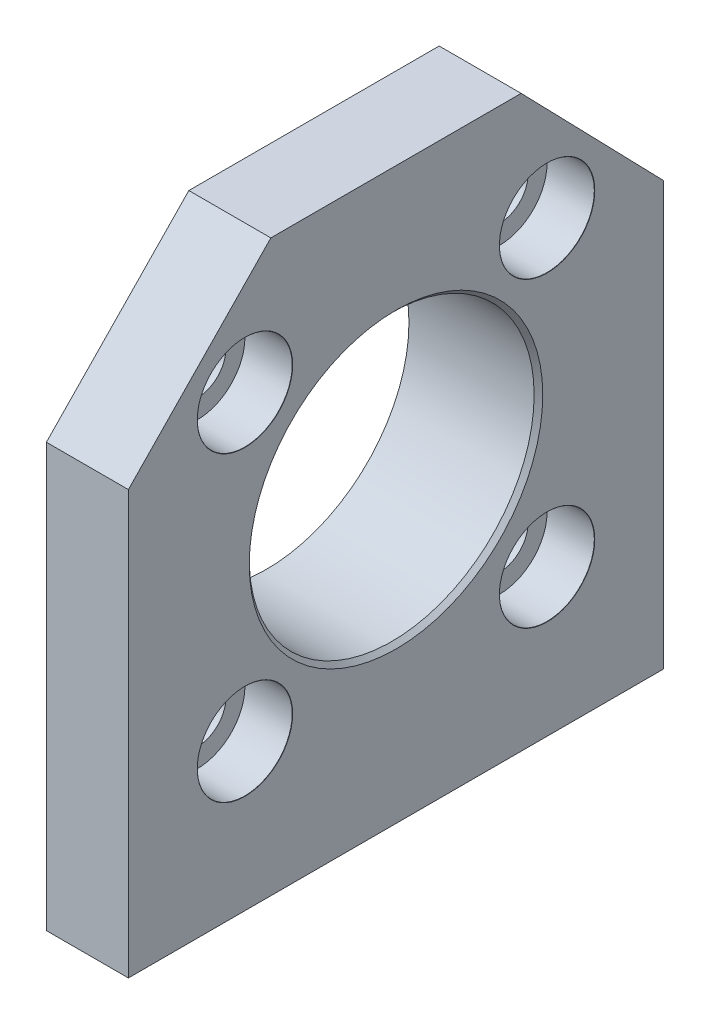
from build123d import *

# Parameters (mm, degrees)
ESBO_O1_W                                    = 31
ESBO_O1_H                                    = 49
RESSALTO_EXTRUS_O1_DEPTH                     = 9.5
REBAIXO_PARA_PARAFUSO_COM_CABE_A_RED_2_COUNT = 2
REBAIXO_PARA_PARAFUSO_COM_CABE_A_RED_2_PITCH = 35
REBAIXO_PARA_PARAFUSO_COM_CABE_A_RED_3_COUNT = 2
REBAIXO_PARA_PARAFUSO_COM_CABE_A_RED_3_PITCH = 49.497474683
REBAIXO_PARA_PARAFUSO_COM_CABE_A_RED_4_COUNT = 2
REBAIXO_PARA_PARAFUSO_COM_CABE_A_RED_4_PITCH = 35
ESBO_O8_R                                    = 19.9
RESSALTO_EXTRUS_O2_DEPTH                     = 5.5
ESBO_O5_R                                    = 16.5
CORTE_EXTRUS_O1_DEPTH                        = 92.787798753
CHANFRO1_SIZE                                = 0.5


with BuildPart() as part:
    # Esboço1 → Ressalto-extrusão1 (new body)
    with BuildSketch(Plane(origin=(0, 0, 0), x_dir=(0, 0, -1), z_dir=(1, 0, 0))):
        Polygon((16.5, 66), (0, 49), (31, 49), (31, 66), align=None)
        Polygon((31, 66), (31, 49), (62, 49), (45.5, 66), align=None)
        with Locations((15.5, 24.5)):
            Rectangle(ESBO_O1_W, ESBO_O1_H)
        with Locations((46.5, 24.5)):
            Rectangle(ESBO_O1_W, ESBO_O1_H)
    extrude(amount=-RESSALTO_EXTRUS_O1_DEPTH)

    # Esboço4 → Rebaixo para parafuso com cabeça redonda de M61 (revolve, cut)
    with BuildSketch(Plane(origin=(0, 52, -13.5), x_dir=(0, 0, -1), z_dir=(0, 1, 0))):
        Polygon((0, 0), (0, 9.5), (3.3, 9.5), (3.3, 5.5), (5.5, 5.5), (5.5, 0.025), (5.525, 0), align=None)
    rebaixo_para_parafuso_com_cabe_a_redonda = revolve(axis=Axis((6.35, 52, -13.5), (-1, 0, 0)), mode=Mode.SUBTRACT)

    # Rebaixo para parafuso com cabe_a red 2: Rebaixo para parafuso com cabeça redonda de M61 ×2
    with Locations(*[(0, 0, -i * REBAIXO_PARA_PARAFUSO_COM_CABE_A_RED_2_PITCH) for i in range(1, REBAIXO_PARA_PARAFUSO_COM_CABE_A_RED_2_COUNT)]):
        add(rebaixo_para_parafuso_com_cabe_a_redonda, mode=Mode.SUBTRACT)

    # Rebaixo para parafuso com cabe_a red 3: Rebaixo para parafuso com cabeça redonda de M61 ×2
    with Locations(*[Vector(0, -0.7071067811865477, -0.7071067811865475) * (i * REBAIXO_PARA_PARAFUSO_COM_CABE_A_RED_3_PITCH) for i in range(1, REBAIXO_PARA_PARAFUSO_COM_CABE_A_RED_3_COUNT)]):
        add(rebaixo_para_parafuso_com_cabe_a_redonda, mode=Mode.SUBTRACT)

    # Rebaixo para parafuso com cabe_a red 4: Rebaixo para parafuso com cabeça redonda de M61 ×2
    with Locations(*[(0, -i * REBAIXO_PARA_PARAFUSO_COM_CABE_A_RED_4_PITCH, 0) for i in range(1, REBAIXO_PARA_PARAFUSO_COM_CABE_A_RED_4_COUNT)]):
        add(rebaixo_para_parafuso_com_cabe_a_redonda, mode=Mode.SUBTRACT)

    # Esboço8 → Ressalto-extrusão2 (add)
    with BuildSketch(Plane.ZY.offset(9.5)):
        with Locations(Location((-31, 34.5, 0), (0, 0, 180))):
            Circle(ESBO_O8_R)
    extrude(amount=RESSALTO_EXTRUS_O2_DEPTH)

    # Esboço5 → Corte-extrusão1 (cut, through all)
    with BuildSketch(Plane(origin=(0, 0, 0), x_dir=(0, 0, -1), z_dir=(1, 0, 0))):
        with Locations((31, 34.5)):
            Circle(ESBO_O5_R)
    extrude(amount=-CORTE_EXTRUS_O1_DEPTH, mode=Mode.SUBTRACT)

    # Chanfro1
    chanfro1_edges = [part.edges().sort_by_distance(p)[0] for p in [
        (0, 34.5, -14.5),
    ]]
    chamfer(chanfro1_edges, length=CHANFRO1_SIZE)


solid = part.part
